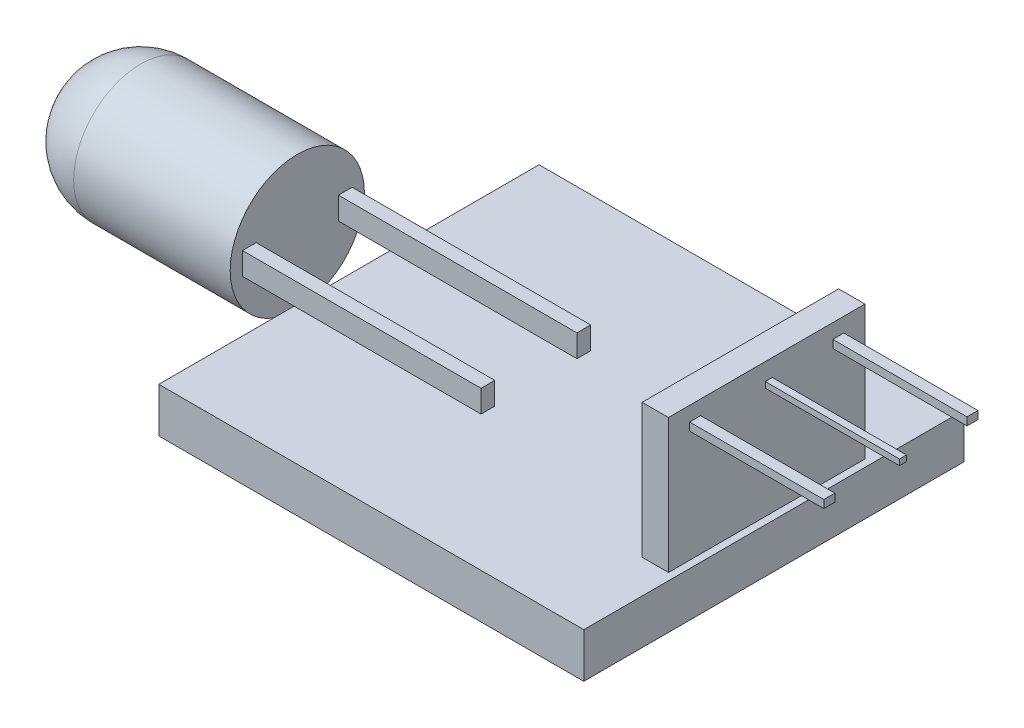
from build123d import *

# Parameters (mm, degrees)
ESQUISSE1_W        = 19
ESQUISSE1_H        = 17
BOSS_EXTRU_1_DEPTH = 2
ESQUISSE2_W        = 1.17663859
ESQUISSE2_H        = 8.785143252
BOSS_EXTRU_2_DEPTH = 6
ESQUISSE3_W        = 0.492340061
ESQUISSE3_H        = 0.351671472
BOSS_EXTRU_3_DEPTH = 6
ESQUISSE4_W        = 0.313154041
ESQUISSE4_H        = 0.257723979
BOSS_EXTRU_4_DEPTH = 6
ESQUISSE5_W        = 0.663647826
ESQUISSE5_H        = 0.612597993
BOSS_EXTRU_5_DEPTH = 1
ESQUISSE6_W        = 0.612597993
ESQUISSE6_H        = 1
BOSS_EXTRU_6_DEPTH = 10
ESQUISSE7_R        = 3
BOSS_EXTRU_7_DEPTH = 10
CONG_2_R           = 3


with BuildPart() as part:
    # Esquisse1 → Boss.-Extru.1 (new body)
    with BuildSketch(Plane(origin=(0, 0, 0), x_dir=(1, 0, 0), z_dir=(0, 1, 0))):
        Rectangle(ESQUISSE1_W, ESQUISSE1_H)
    extrude(amount=BOSS_EXTRU_1_DEPTH)

    # Esquisse2 → Boss.-Extru.2 (add)
    with BuildSketch(Plane(origin=(0, 2, 0), x_dir=(1, 0, 0), z_dir=(0, 1, 0))):
        with Locations((8.589461706, 0)):
            Rectangle(ESQUISSE2_W, ESQUISSE2_H)
    extrude(amount=BOSS_EXTRU_2_DEPTH)

    # Esquisse3 → Boss.-Extru.3 (add)
    with BuildSketch(Plane(origin=(9.177781001, 0, 0), x_dir=(0, 0, -1), z_dir=(1, 0, 0))):
        with Locations((-3.200210394, 7.175487816)):
            Rectangle(ESQUISSE3_W, ESQUISSE3_H)
    boss_extru_3 = extrude(amount=BOSS_EXTRU_3_DEPTH)

    # Symétrie1: Boss.-Extru.3 across plane
    add(boss_extru_3.mirror(Plane.XY))

    # Esquisse4 → Boss.-Extru.4 (add)
    with BuildSketch(Plane(origin=(9.177781001, 0, 0), x_dir=(0, 0, -1), z_dir=(1, 0, 0))):
        with Locations((0.092212431, 7.099938204)):
            Rectangle(ESQUISSE4_W, ESQUISSE4_H)
    extrude(amount=BOSS_EXTRU_4_DEPTH)

    # Esquisse5 → Boss.-Extru.5 (add)
    with BuildSketch(Plane(origin=(0, 2, 0), x_dir=(1, 0, 0), z_dir=(0, 1, 0))):
        with Locations((-1.474820367, -2.144092976)):
            Rectangle(ESQUISSE5_W, ESQUISSE5_H)
    boss_extru_5 = extrude(amount=BOSS_EXTRU_5_DEPTH)

    # Esquisse6 → Boss.-Extru.6 (add)
    with BuildSketch(Plane.ZY.offset(1.80664428)):
        with Locations((2.144092976, 2.5)):
            Rectangle(ESQUISSE6_W, ESQUISSE6_H)
    boss_extru_6 = extrude(amount=BOSS_EXTRU_6_DEPTH)

    # Symétrie2: Boss.-Extru.5, Boss.-Extru.6 across plane
    add(boss_extru_5.mirror(Plane.XY))
    add(boss_extru_6.mirror(Plane.XY))

    # Esquisse7 → Boss.-Extru.7 (add)
    with BuildSketch(Plane.ZY.offset(11.80664428)):
        with Locations((0, 2.5)):
            Circle(ESQUISSE7_R)
    extrude(amount=BOSS_EXTRU_7_DEPTH)

    # Congé2
    cong_2_edges = [part.edges().sort_by_distance(p)[0] for p in [
        (-21.80664428, 2.5, -3),
    ]]
    fillet(cong_2_edges, radius=CONG_2_R)


solid = part.part
